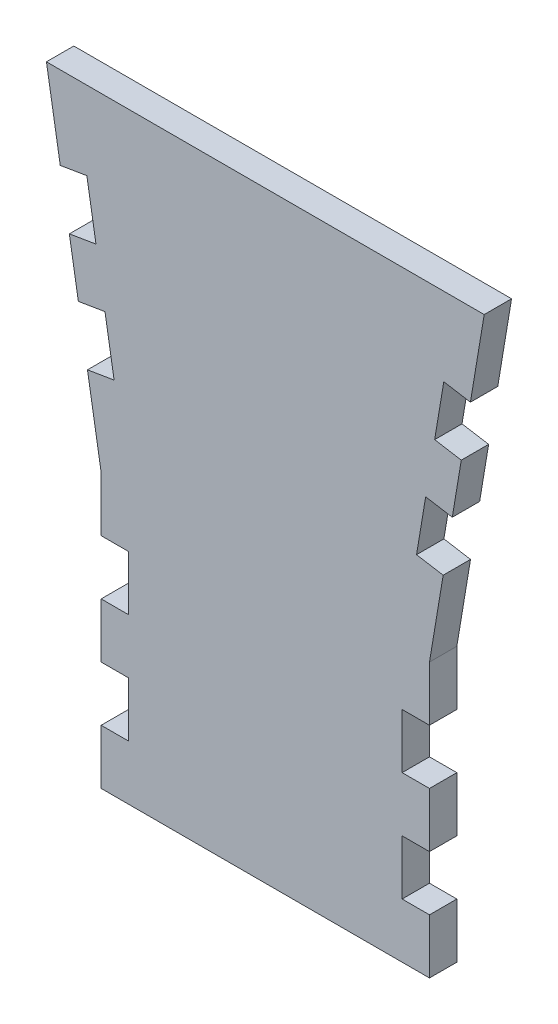
from build123d import *

# Parameters (mm, degrees)
BOSS_EXTRU_1_DEPTH = 5


with BuildPart() as part:
    # Model → Boss.-Extru.1 (new body)
    with BuildSketch(Plane.XY):
        Polygon((-23.823529412, 20), (-18.823529412, 20), (-18.823529412, 10), (-23.823529412, 10), (-23.823529412, 0), (36.176470588, 0), (36.176470588, 10), (31.176470588, 10), (31.176470588, 20), (36.176470588, 20), (36.176470588, 30), (31.176470588, 30), (31.176470588, 40), (36.176470588, 40), (36.176470588, 50), (38.676470588, 65), (33.811605723, 65.810810811), (35.47827239, 75.810810811), (40.343137255, 75), (41.987127128, 84.863939238), (37.122262263, 85.674750049), (38.78892893, 95.674750049), (43.653793795, 94.863939238), (46.176470588, 110), (-33.823529412, 110), (-31.300852618, 94.863939238), (-26.435987753, 95.674750049), (-24.769321087, 85.674750049), (-29.634185952, 84.863939238), (-27.990196078, 75), (-23.125331214, 75.810810811), (-21.458664547, 65.810810811), (-26.323529412, 65), (-23.823529412, 50), (-23.823529412, 40), (-18.823529412, 40), (-18.823529412, 30), (-23.823529412, 30), align=None)
    extrude(amount=BOSS_EXTRU_1_DEPTH)


solid = part.part
